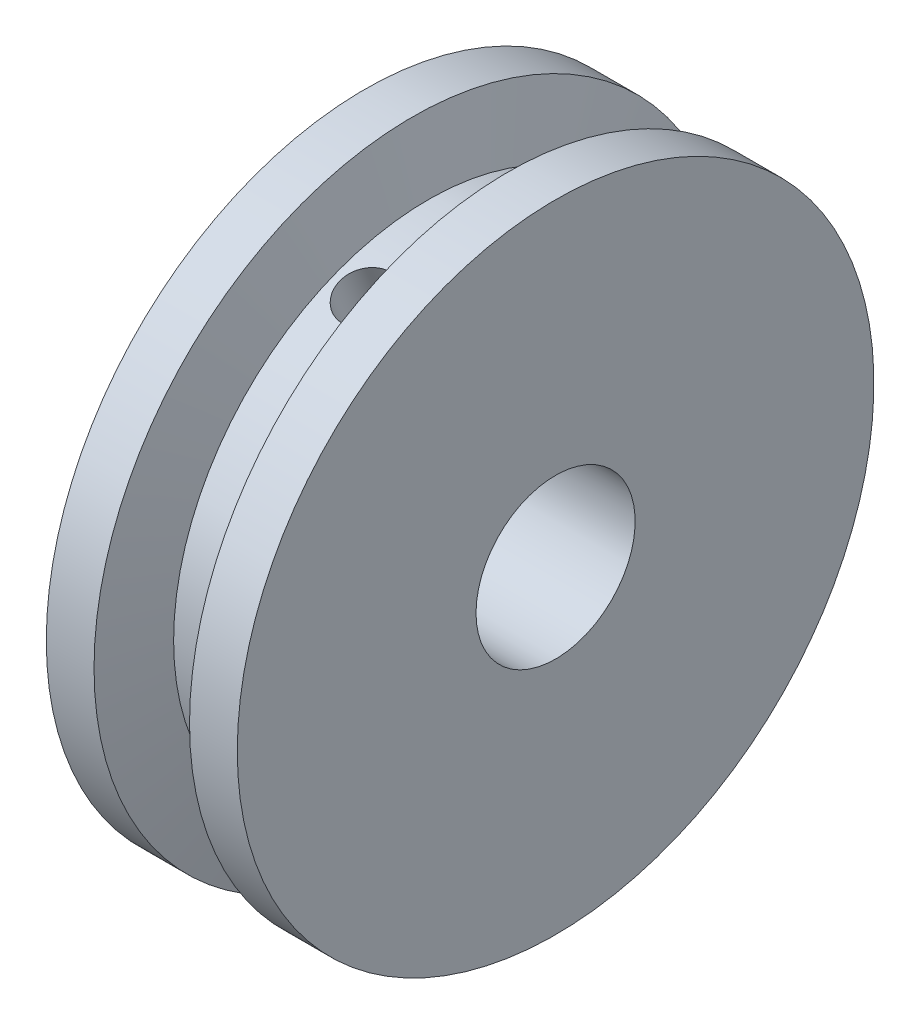
from build123d import *

# Parameters (mm, degrees)
M4X0_7_TAPPED_HOLE1_D     = 3.3
M4X0_7_TAPPED_HOLE1_DEPTH = 12


with BuildPart() as part:
    # Sketch1 → Revolve1 (revolve)
    with BuildSketch(Plane.XY, mode=Mode.PRIVATE) as revolve1_sk:
        Polygon((-2, 1.740967464), (2, 1.740967464), (3, 5.740967464), (6, 5.740967464), (6, -9.259032536), (-6, -9.259032536), (-6, 5.740967464), (-3, 5.740967464), align=None)
    revolve(revolve1_sk.sketch.rotate(Axis((-24.289514567, -14.259032536, 0), (1, 0, 0)), 90), axis=Axis((-24.289514567, -14.259032536, 0), (1, 0, 0)))

    # M4x0.7 Tapped Hole1
    with Locations(Plane(origin=(0.112968309, 0.556468612, 6.041599599), x_dir=(0, -0.377599974944, 0.925968821787), z_dir=(0, 0.925968821787, 0.377599974944))):
        with Locations((0, 0)):
            Hole(M4X0_7_TAPPED_HOLE1_D / 2, depth=M4X0_7_TAPPED_HOLE1_DEPTH)


solid = part.part
